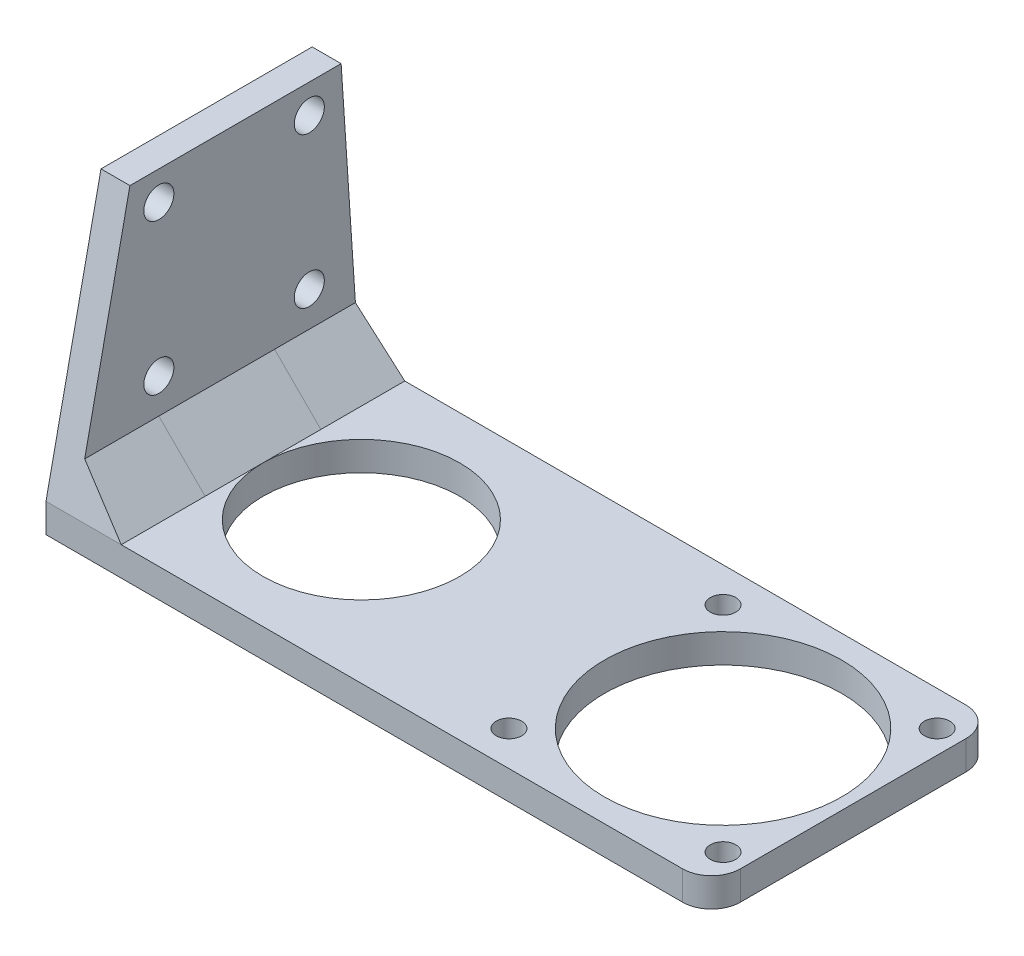
from build123d import *

# Parameters (mm, degrees)
SKETCH1_W           = 45
SKETCH1_H           = 45
SKETCH1_R           = 20.5
BOSS_EXTRUDE1_DEPTH = 5
CUT_EXTRUDE1_REACH  = 34.21
SKETCH2_R           = 2.2
BOSS_EXTRUDE2_DEPTH = 5
BOSS_EXTRUDE4_DEPTH = 5
SKETCH6_R           = 2.6
CUT_EXTRUDE2_DEPTH  = 5
SKETCH7_R           = 17
CUT_EXTRUDE3_DEPTH  = 5
BOSS_EXTRUDE5_DEPTH = 10
CHAMFER1_SIZE       = 8
FILLET1_R           = 5


with BuildPart() as part:
    # Sketch1 → Boss-Extrude1 (new body)
    with BuildSketch(Plane(origin=(0, 0, 0), x_dir=(1, 0, 0), z_dir=(0, 1, 0))):
        Rectangle(SKETCH1_W, SKETCH1_H)
        with Locations(Location((0, 0, 0), (0, 0, 270))):
            Circle(SKETCH1_R, mode=Mode.SUBTRACT)
    extrude(amount=BOSS_EXTRUDE1_DEPTH)

    # Sketch2 → Cut-Extrude1 (cut, up to next)
    with BuildSketch(Plane(origin=(0, 0, 0), x_dir=(1, 0, 0), z_dir=(0, 1, 0)), mode=Mode.PRIVATE) as cut_extrude1_sk1:
        with Locations(Location((18.5, 18.5, 0), (0, 0, 90))):
            Circle(SKETCH2_R)
    cut_extrude1_tool1 = extrude(cut_extrude1_sk1.sketch, amount=CUT_EXTRUDE1_REACH, mode=Mode.PRIVATE) & part.part
    # Sketch2 → Cut-Extrude1 (cut, up to next)
    with BuildSketch(Plane(origin=(0, 0, 0), x_dir=(1, 0, 0), z_dir=(0, 1, 0)), mode=Mode.PRIVATE) as cut_extrude1_sk2:
        with Locations(Location((18.5, -18.5, 0), (0, 0, 270))):
            Circle(SKETCH2_R)
    cut_extrude1_tool2 = extrude(cut_extrude1_sk2.sketch, amount=CUT_EXTRUDE1_REACH, mode=Mode.PRIVATE) & part.part
    # Sketch2 → Cut-Extrude1 (cut, up to next)
    with BuildSketch(Plane(origin=(0, 0, 0), x_dir=(1, 0, 0), z_dir=(0, 1, 0)), mode=Mode.PRIVATE) as cut_extrude1_sk3:
        with Locations(Location((-18.5, 18.5, 0), (0, 0, 270))):
            Circle(SKETCH2_R)
    cut_extrude1_tool3 = extrude(cut_extrude1_sk3.sketch, amount=CUT_EXTRUDE1_REACH, mode=Mode.PRIVATE) & part.part
    # Sketch2 → Cut-Extrude1 (cut, up to next)
    with BuildSketch(Plane(origin=(0, 0, 0), x_dir=(1, 0, 0), z_dir=(0, 1, 0)), mode=Mode.PRIVATE) as cut_extrude1_sk4:
        with Locations(Location((-18.5, -18.5, 0), (0, 0, 90))):
            Circle(SKETCH2_R)
    cut_extrude1_tool4 = extrude(cut_extrude1_sk4.sketch, amount=CUT_EXTRUDE1_REACH, mode=Mode.PRIVATE) & part.part
    add(cut_extrude1_tool1.solids().sort_by_distance((18.5, 0, -18.5))[0], mode=Mode.SUBTRACT)
    add(cut_extrude1_tool2.solids().sort_by_distance((18.5, 0, 18.5))[0], mode=Mode.SUBTRACT)
    add(cut_extrude1_tool3.solids().sort_by_distance((-18.5, 0, -18.5))[0], mode=Mode.SUBTRACT)
    add(cut_extrude1_tool4.solids().sort_by_distance((-18.5, 0, 18.5))[0], mode=Mode.SUBTRACT)

    # Sketch3 → Boss-Extrude2 (add)
    with BuildSketch(Plane(origin=(0, 0, 0), x_dir=(1, 0, 0), z_dir=(0, 1, 0))):
        Polygon((22.5, 22.5), (22.5, 24.5), (-92.5, 24.5), (-92.5, -24.5), (22.5, -24.5), (22.5, -22.5), (-22.5, -22.5), (-22.5, 22.5), align=None)
    extrude(amount=BOSS_EXTRUDE2_DEPTH)

    # Sketch7 → Cut-Extrude3 (cut)
    with BuildSketch(Plane(origin=(0, 0, 0), x_dir=(1, 0, 0), z_dir=(0, 1, 0))):
        with Locations(Location((-62.5, 0, 0), (0, 0, 270))):
            Circle(SKETCH7_R)
    extrude(amount=CUT_EXTRUDE3_DEPTH, mode=Mode.SUBTRACT)



with BuildPart() as body_2:
    # Sketch5 → Boss-Extrude4 (new body)
    with BuildSketch(Plane.ZY.offset(92.5)):
        Polygon((-24.5, 5), (-21.5, 50), (15, 50), (24.5, 5), (24.5, 0), (-24.5, 0), align=None)
    extrude(amount=-BOSS_EXTRUDE4_DEPTH)

    # Sketch6 → Cut-Extrude2 (cut)
    with BuildSketch(Plane(origin=(-87.5, 0, 0), x_dir=(0, 0, -1), z_dir=(1, 0, 0))):
        with Locations((16, 45)):
            Circle(SKETCH6_R)
        with Locations((16, 19)):
            Circle(SKETCH6_R)
        with Locations(Location((-10, 19, 0), (0, 0, 180))):
            Circle(SKETCH6_R)
        with Locations(Location((-10, 45, 0), (0, 0, 180))):
            Circle(SKETCH6_R)
    extrude(amount=-CUT_EXTRUDE2_DEPTH, mode=Mode.SUBTRACT)


with BuildPart() as part_1:
    add(part.part)

    add(body_2.part)  # Boss-Extrude5 merges body 2
    # Sketch8 → Boss-Extrude5 (add, symmetric)
    with BuildSketch(Plane.XY):
        Polygon((-87.5, 5), (-87.5, 13), (-79.5, 5), align=None)
    extrude(amount=BOSS_EXTRUDE5_DEPTH, both=True)

    # Chamfer1
    chamfer1_edges = [part_1.edges().sort_by_distance(p)[0] for p in [
        (-87.5, 5, -17.25),
        (-87.5, 5, 17.25),
    ]]
    chamfer(chamfer1_edges, length=CHAMFER1_SIZE)

    # Fillet1
    fillet1_edges = [part_1.edges().sort_by_distance(p)[0] for p in [
        (22.5, 2.5, -24.5),
        (22.5, 2.5, 24.5),
    ]]
    fillet(fillet1_edges, radius=FILLET1_R)


solid = part_1.part
